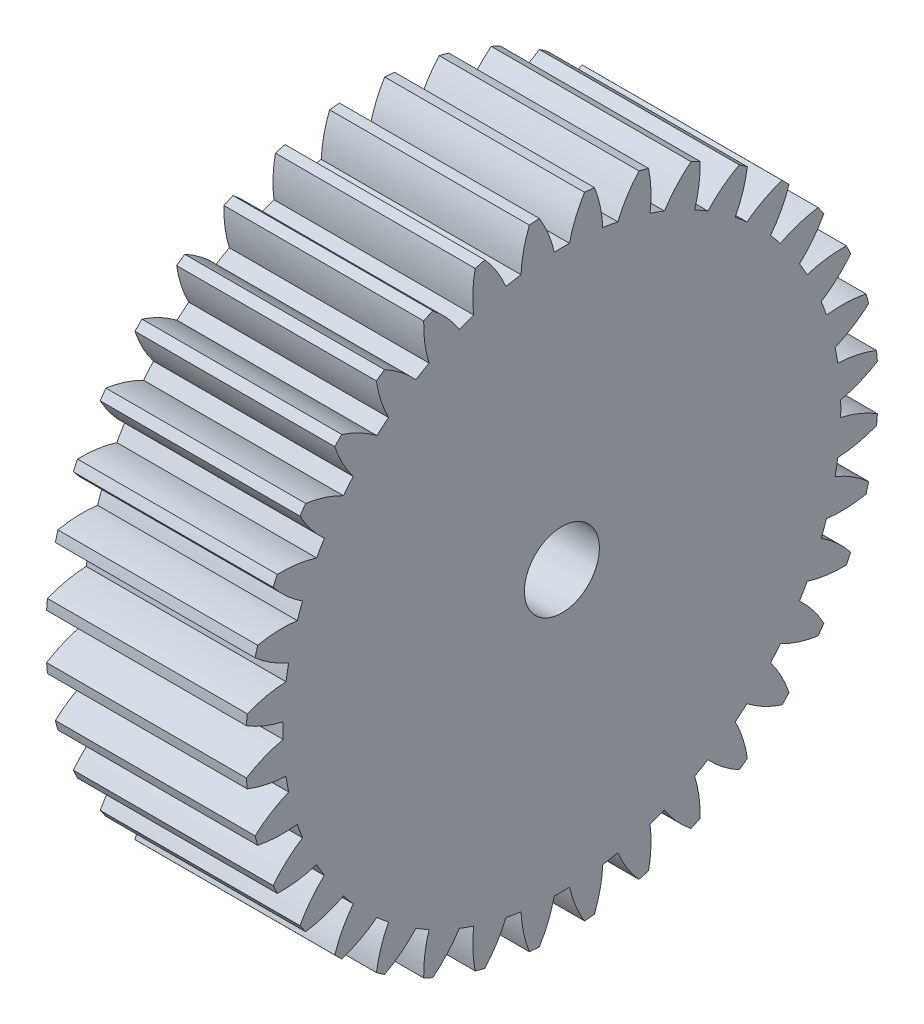
from build123d import *

# Parameters (mm, degrees)
BASPROSKE_W     = 12.7
BASPROSKE_H     = 20.108333333
TOOTHCUT_DEPTH  = 32.144504152
TEETHCUTS_COUNT = 36
TEETHCUTS_ANGLE = 350
BORSKE_R        = 2.38125
BORE_DEPTH      = 50.8000508


with BuildPart() as part:
    # BasProSke → Base-Revolve (revolve)
    with BuildSketch(Plane(origin=(0, 0, 0), x_dir=(1, 0, 0), z_dir=(0, 1, 0)), mode=Mode.PRIVATE) as base_revolve_sk:
        with Locations((6.35, 10.054166667)):
            Rectangle(BASPROSKE_W, BASPROSKE_H)
    revolve(base_revolve_sk.sketch.rotate(Axis((-10, 0, 0), (1, 0, 0)), 180), axis=Axis((-10, 0, 0), (1, 0, 0)))

    # TooCutSke → ToothCut (cut, through all)
    with BuildSketch(Plane(origin=(0, 0, 0), x_dir=(0, 0, -1), z_dir=(1, 0, 0))):
        with BuildLine():
            ThreePointArc((0.485894828, 17.722540418), (0, 17.7292), (-0.485894828, 17.722540418))
            ThreePointArc((-0.485894828, 17.722540418), (-0.869820886, 18.942611253), (-1.452410194, 20.081277912))
            ThreePointArc((-1.452410194, 20.081277912), (0, 20.133733333), (1.452410194, 20.081277912))
            ThreePointArc((1.452410194, 20.081277912), (0.869820886, 18.942611253), (0.485894828, 17.722540418))
        make_face()
    toothcut = extrude(amount=TOOTHCUT_DEPTH, mode=Mode.SUBTRACT)

    # TeethCuts: ToothCut ×36 about axis
    teethcuts_axis = Axis((-10, 0, 0), (1, 0, 0))
    for i in range(1, TEETHCUTS_COUNT):
        add(toothcut.rotate(teethcuts_axis, i * TEETHCUTS_ANGLE / (TEETHCUTS_COUNT - 1)), mode=Mode.SUBTRACT)

    # BorSke → Bore (cut, symmetric)
    with BuildSketch(Plane(origin=(0, 0, 0), x_dir=(0, 0, -1), z_dir=(1, 0, 0))):
        with Locations(Location((0, 0, 0), (0, 0, 180))):
            Circle(BORSKE_R)
    extrude(amount=BORE_DEPTH, both=True, mode=Mode.SUBTRACT)


solid = part.part
